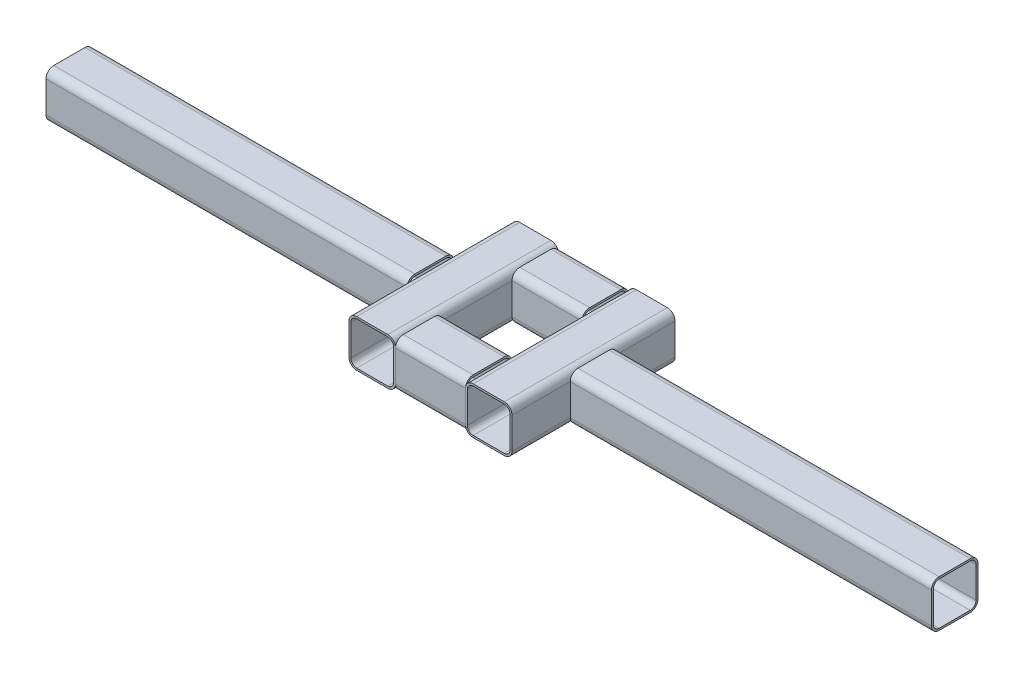
from build123d import *

# Parameters (mm, degrees)
STRUCTURAL_MEMBER1_DEPTH   = 1447.8
SKETCH12_W                 = 266.7
SKETCH12_H                 = 76.2
CUT_EXTRUDE1_DEPTH         = 1451.304412873
STRUCTURAL_MEMBER2_DEPTH   = 266.7
STRUCTURAL_MEMBER2_2_DEPTH = 266.7
STRUCTURAL_MEMBER3_DEPTH   = 114.3
STRUCTURAL_MEMBER3_2_DEPTH = 114.3


with BuildPart() as part:
    # Sketch11 → Structural Member1 (new body)
    with BuildSketch(Plane.YZ):
        with BuildLine():
            Line((-25.4, -38.1), (25.4, -38.1))
            ThreePointArc((25.4, -38.1), (34.380256121, -34.380256121), (38.1, -25.4))
            Line((38.1, -25.4), (38.1, 25.4))
            ThreePointArc((38.1, 25.4), (34.380256121, 34.380256121), (25.4, 38.1))
            Line((25.4, 38.1), (-25.4, 38.1))
            ThreePointArc((-25.4, 38.1), (-34.380256121, 34.380256121), (-38.1, 25.4))
            Line((-38.1, 25.4), (-38.1, -25.4))
            ThreePointArc((-38.1, -25.4), (-34.380256121, -34.380256121), (-25.4, -38.1))
        make_face()
        with BuildLine():
            Line((-25.4, -34.925), (25.4, -34.925))
            ThreePointArc((25.4, -34.925), (32.135192091, -32.135192091), (34.925, -25.4))
            Line((34.925, -25.4), (34.925, 25.4))
            ThreePointArc((34.925, 25.4), (32.135192091, 32.135192091), (25.4, 34.925))
            Line((25.4, 34.925), (-25.4, 34.925))
            ThreePointArc((-25.4, 34.925), (-32.135192091, 32.135192091), (-34.925, 25.4))
            Line((-34.925, 25.4), (-34.925, -25.4))
            ThreePointArc((-34.925, -25.4), (-32.135192091, -32.135192091), (-25.4, -34.925))
        make_face(mode=Mode.SUBTRACT)
    extrude(amount=STRUCTURAL_MEMBER1_DEPTH)

    # Sketch12 → Cut-Extrude1 (cut, through all)
    with BuildSketch(Plane(origin=(0, 0, -38.1), x_dir=(-1, 0, 0), z_dir=(0, 0, -1))):
        with Locations((-723.9, 0)):
            Rectangle(SKETCH12_W, SKETCH12_H)
    extrude(amount=-CUT_EXTRUDE1_DEPTH, mode=Mode.SUBTRACT)


with BuildPart() as cut_extrude1_piece_1:
    # of the separate pieces the step leaves, piece 1, a body of its own (cut_extrude1_pieces)
    add(part.part.solids().sort_by_distance((857.25, -25.4, -38.1))[0])


with BuildPart() as cut_extrude1_piece_2:
    # of the separate pieces the step leaves, piece 2, a body of its own (cut_extrude1_pieces)
    add(part.part.solids().sort_by_distance((0, -25.4, -38.1))[0])


with BuildPart() as body_3:
    # Sketch15 → Structural Member2 (new body)
    with BuildSketch(Plane(origin=(628.65, 0, -133.35), x_dir=(1, 0, 0), z_dir=(0, 0, 1))):
        with BuildLine():
            Line((-25.4, -38.1), (25.4, -38.1))
            ThreePointArc((25.4, -38.1), (34.380256121, -34.380256121), (38.1, -25.4))
            Line((38.1, -25.4), (38.1, 25.4))
            ThreePointArc((38.1, 25.4), (34.380256121, 34.380256121), (25.4, 38.1))
            Line((25.4, 38.1), (-25.4, 38.1))
            ThreePointArc((-25.4, 38.1), (-34.380256121, 34.380256121), (-38.1, 25.4))
            Line((-38.1, 25.4), (-38.1, -25.4))
            ThreePointArc((-38.1, -25.4), (-34.380256121, -34.380256121), (-25.4, -38.1))
        make_face()
        with BuildLine():
            Line((-25.4, -34.925), (25.4, -34.925))
            ThreePointArc((25.4, -34.925), (32.135192091, -32.135192091), (34.925, -25.4))
            Line((34.925, -25.4), (34.925, 25.4))
            ThreePointArc((34.925, 25.4), (32.135192091, 32.135192091), (25.4, 34.925))
            Line((25.4, 34.925), (-25.4, 34.925))
            ThreePointArc((-25.4, 34.925), (-32.135192091, 32.135192091), (-34.925, 25.4))
            Line((-34.925, 25.4), (-34.925, -25.4))
            ThreePointArc((-34.925, -25.4), (-32.135192091, -32.135192091), (-25.4, -34.925))
        make_face(mode=Mode.SUBTRACT)
    extrude(amount=STRUCTURAL_MEMBER2_DEPTH)


with BuildPart() as body_4:
    # Sketch15 on segment 2 (carried to segment 2) → Structural Member2 2 (new body)
    with BuildSketch(Plane(origin=(819.15, 0, -133.35), x_dir=(1, 0, 0), z_dir=(0, 0, 1))):
        with BuildLine():
            Line((-25.4, -38.1), (25.4, -38.1))
            ThreePointArc((25.4, -38.1), (34.380256121, -34.380256121), (38.1, -25.4))
            Line((38.1, -25.4), (38.1, 25.4))
            ThreePointArc((38.1, 25.4), (34.380256121, 34.380256121), (25.4, 38.1))
            Line((25.4, 38.1), (-25.4, 38.1))
            ThreePointArc((-25.4, 38.1), (-34.380256121, 34.380256121), (-38.1, 25.4))
            Line((-38.1, 25.4), (-38.1, -25.4))
            ThreePointArc((-38.1, -25.4), (-34.380256121, -34.380256121), (-25.4, -38.1))
        make_face()
        with BuildLine():
            Line((-25.4, -34.925), (25.4, -34.925))
            ThreePointArc((25.4, -34.925), (32.135192091, -32.135192091), (34.925, -25.4))
            Line((34.925, -25.4), (34.925, 25.4))
            ThreePointArc((34.925, 25.4), (32.135192091, 32.135192091), (25.4, 34.925))
            Line((25.4, 34.925), (-25.4, 34.925))
            ThreePointArc((-25.4, 34.925), (-32.135192091, 32.135192091), (-34.925, 25.4))
            Line((-34.925, 25.4), (-34.925, -25.4))
            ThreePointArc((-34.925, -25.4), (-32.135192091, -32.135192091), (-25.4, -34.925))
        make_face(mode=Mode.SUBTRACT)
    extrude(amount=STRUCTURAL_MEMBER2_2_DEPTH)


with BuildPart() as body_5:
    # Sketch17 → Structural Member3 (new body)
    with BuildSketch(Plane(origin=(781.05, 0, -95.25), x_dir=(0, 0, 1), z_dir=(-1, 0, 0))):
        with BuildLine():
            Line((-25.4, -38.1), (25.4, -38.1))
            ThreePointArc((25.4, -38.1), (34.380256121, -34.380256121), (38.1, -25.4))
            Line((38.1, -25.4), (38.1, 25.4))
            ThreePointArc((38.1, 25.4), (34.380256121, 34.380256121), (25.4, 38.1))
            Line((25.4, 38.1), (-25.4, 38.1))
            ThreePointArc((-25.4, 38.1), (-34.380256121, 34.380256121), (-38.1, 25.4))
            Line((-38.1, 25.4), (-38.1, -25.4))
            ThreePointArc((-38.1, -25.4), (-34.380256121, -34.380256121), (-25.4, -38.1))
        make_face()
        with BuildLine():
            Line((-25.4, -34.925), (25.4, -34.925))
            ThreePointArc((25.4, -34.925), (32.135192091, -32.135192091), (34.925, -25.4))
            Line((34.925, -25.4), (34.925, 25.4))
            ThreePointArc((34.925, 25.4), (32.135192091, 32.135192091), (25.4, 34.925))
            Line((25.4, 34.925), (-25.4, 34.925))
            ThreePointArc((-25.4, 34.925), (-32.135192091, 32.135192091), (-34.925, 25.4))
            Line((-34.925, 25.4), (-34.925, -25.4))
            ThreePointArc((-34.925, -25.4), (-32.135192091, -32.135192091), (-25.4, -34.925))
        make_face(mode=Mode.SUBTRACT)
    extrude(amount=STRUCTURAL_MEMBER3_DEPTH)


with BuildPart() as body_6:
    # Sketch17 on segment 2 (carried to segment 2) → Structural Member3 2 (new body)
    with BuildSketch(Plane(origin=(781.05, 0, 95.25), x_dir=(0, 0, 1), z_dir=(-1, 0, 0))):
        with BuildLine():
            Line((-25.4, -38.1), (25.4, -38.1))
            ThreePointArc((25.4, -38.1), (34.380256121, -34.380256121), (38.1, -25.4))
            Line((38.1, -25.4), (38.1, 25.4))
            ThreePointArc((38.1, 25.4), (34.380256121, 34.380256121), (25.4, 38.1))
            Line((25.4, 38.1), (-25.4, 38.1))
            ThreePointArc((-25.4, 38.1), (-34.380256121, 34.380256121), (-38.1, 25.4))
            Line((-38.1, 25.4), (-38.1, -25.4))
            ThreePointArc((-38.1, -25.4), (-34.380256121, -34.380256121), (-25.4, -38.1))
        make_face()
        with BuildLine():
            Line((-25.4, -34.925), (25.4, -34.925))
            ThreePointArc((25.4, -34.925), (32.135192091, -32.135192091), (34.925, -25.4))
            Line((34.925, -25.4), (34.925, 25.4))
            ThreePointArc((34.925, 25.4), (32.135192091, 32.135192091), (25.4, 34.925))
            Line((25.4, 34.925), (-25.4, 34.925))
            ThreePointArc((-25.4, 34.925), (-32.135192091, 32.135192091), (-34.925, 25.4))
            Line((-34.925, 25.4), (-34.925, -25.4))
            ThreePointArc((-34.925, -25.4), (-32.135192091, -32.135192091), (-25.4, -34.925))
        make_face(mode=Mode.SUBTRACT)
    extrude(amount=STRUCTURAL_MEMBER3_2_DEPTH)


solid = Compound([cut_extrude1_piece_1.part, cut_extrude1_piece_2.part, body_3.part, body_4.part, body_5.part, body_6.part])
